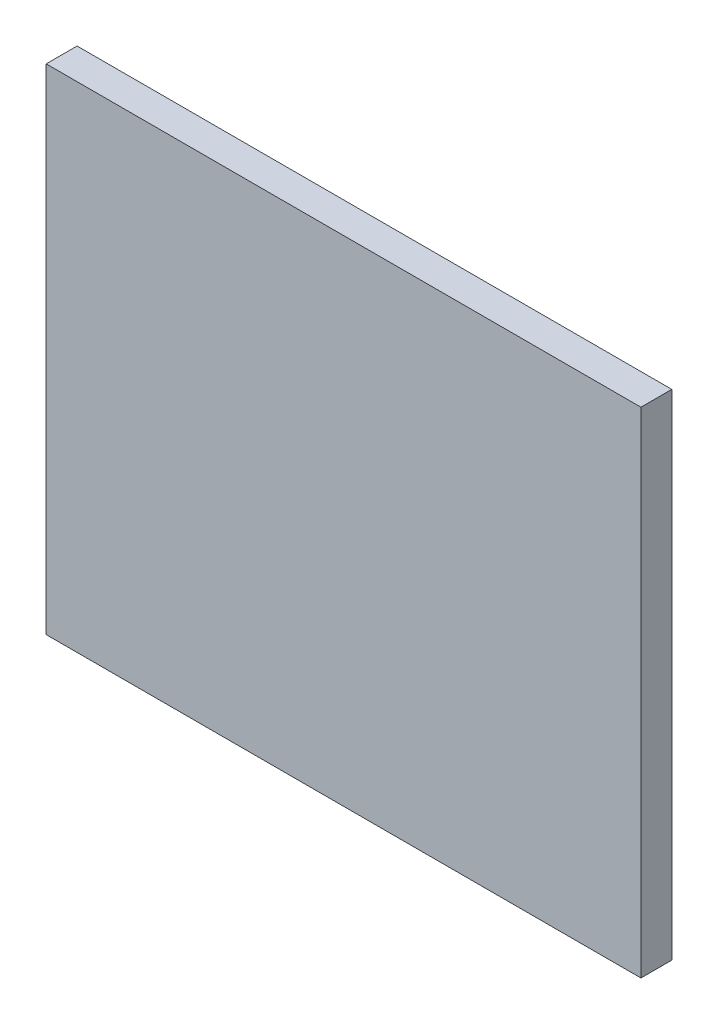
from build123d import *

# Parameters (mm, degrees)
SKETCH1_W           = 77
SKETCH1_H           = 64
BOSS_EXTRUDE1_DEPTH = 4


with BuildPart() as part:
    # Sketch1 → Boss-Extrude1 (new body)
    with BuildSketch(Plane.XY):
        Rectangle(SKETCH1_W, SKETCH1_H)
    extrude(amount=BOSS_EXTRUDE1_DEPTH)


solid = part.part
